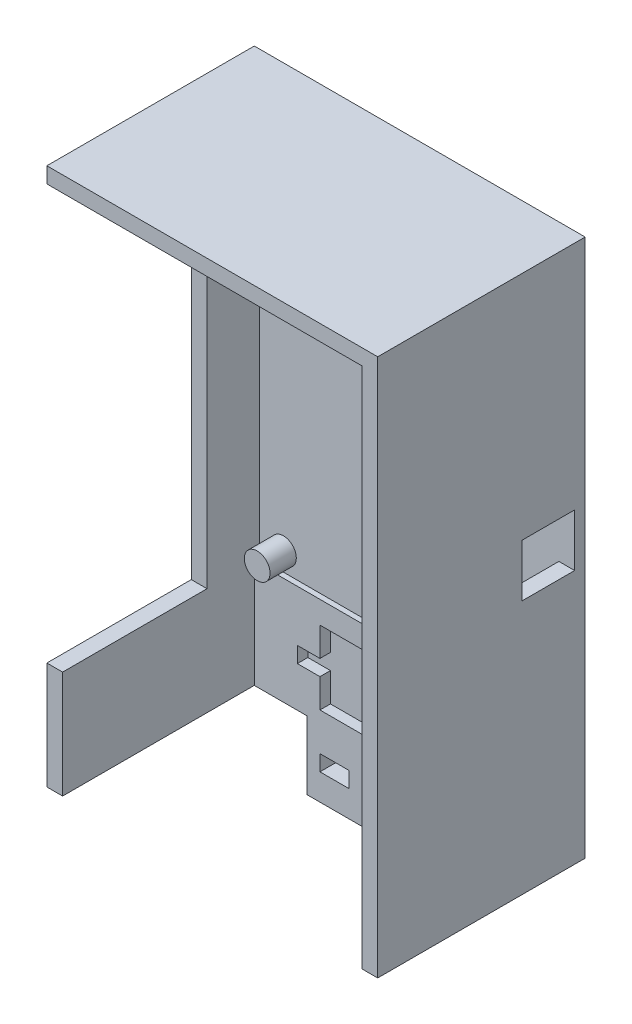
from build123d import *

# Parameters (mm, degrees)
P_IDAT_VYSUNUT_M1_DEPTH  = 2
SKICA3_R                 = 2.45
P_IDAT_VYSUNUT_M3_DEPTH  = 5
P_IDAT_VYSUNUT_M4_DEPTH  = 37.5
SKICA8_W                 = 10
SKICA8_H                 = 10
ODEBRAT_VYSUNUT_M2_DEPTH = 136.974087605
SKICA10_W                = 27.5
SKICA10_H                = 79
ODEBRAT_VYSUNUT_M3_DEPTH = 3
P_IDAT_VYSUNUT_M5_DEPTH  = 1
ODEBRAT_VYSUNUT_M4_DEPTH = 2
SKICA12_3_W              = 5.5
SKICA12_3_H              = 3
ODEBRAT_VYSUNUT_M5_DEPTH = 137.49158399


with BuildPart() as part:
    # Skica1 → Přidat vysunutím1 (new body)
    with BuildSketch(Plane.XY):
        Polygon((13, -102.45), (13, -115.45), (50, -115.45), (50, -102.45), (63, -102.45), (63, 0), (0, 0), (0, -102.45), align=None)
    extrude(amount=P_IDAT_VYSUNUT_M1_DEPTH)

    # Skica3 → Přidat vysunutím3 (add)
    with BuildSketch(Plane.XY.offset(2)):
        with Locations((7.55, -6.45)):
            Circle(SKICA3_R)
        with Locations((7.55, -78.45)):
            Circle(SKICA3_R)
        with Locations((55.55, -78.45)):
            Circle(SKICA3_R)
        with Locations((55.55, -6.45)):
            Circle(SKICA3_R)
    extrude(amount=P_IDAT_VYSUNUT_M3_DEPTH)

    # Skica4 → Přidat vysunutím4 (add)
    with BuildSketch(Plane.XY.offset(2)):
        Polygon((63, 0), (63, -102.45), (60, -102.45), (60, -3), (3, -3), (3, -102.45), (0, -102.45), (0, 0), align=None)
    extrude(amount=P_IDAT_VYSUNUT_M4_DEPTH)

    # Skica8 → Odebrat vysunutím2 (cut, through all)
    with BuildSketch(Plane.ZY.offset(-60)):
        with Locations((7, -49)):
            Rectangle(SKICA8_W, SKICA8_H)
    extrude(amount=-ODEBRAT_VYSUNUT_M2_DEPTH, mode=Mode.SUBTRACT)

    # Skica10 → Odebrat vysunutím3 (cut)
    with BuildSketch(Plane.ZY):
        with Locations((25.75, -42.5)):
            Rectangle(SKICA10_W, SKICA10_H)
    extrude(amount=-ODEBRAT_VYSUNUT_M3_DEPTH, mode=Mode.SUBTRACT)

    # Skica11 → Přidat vysunutím5 (add)
    with BuildSketch(Plane.XY.offset(2)):
        Polygon((3, -82), (60, -82), (60, -102.45), (50, -102.45), (50, -115.45), (13, -115.45), (13, -102.45), (3, -102.45), align=None)
    extrude(amount=P_IDAT_VYSUNUT_M5_DEPTH)

    # Skica12 → Odebrat vysunutím4 (cut)
    with BuildSketch(Plane.XY.offset(3)):
        Polygon((15.5, -86.25), (15.5, -91.75), (11.2, -91.75), (11.2, -94.75), (15.5, -94.75), (15.5, -100.25), (46.5, -100.25), (46.5, -86.25), align=None)
    extrude(amount=-ODEBRAT_VYSUNUT_M4_DEPTH, mode=Mode.SUBTRACT)

    # Skica12<3> → Odebrat vysunutím5 (cut, through all)
    with BuildSketch(Plane.XY.offset(3)):
        with Locations((18.25, -108.95)):
            Rectangle(SKICA12_3_W, SKICA12_3_H)
    extrude(amount=-ODEBRAT_VYSUNUT_M5_DEPTH, mode=Mode.SUBTRACT)


solid = part.part
